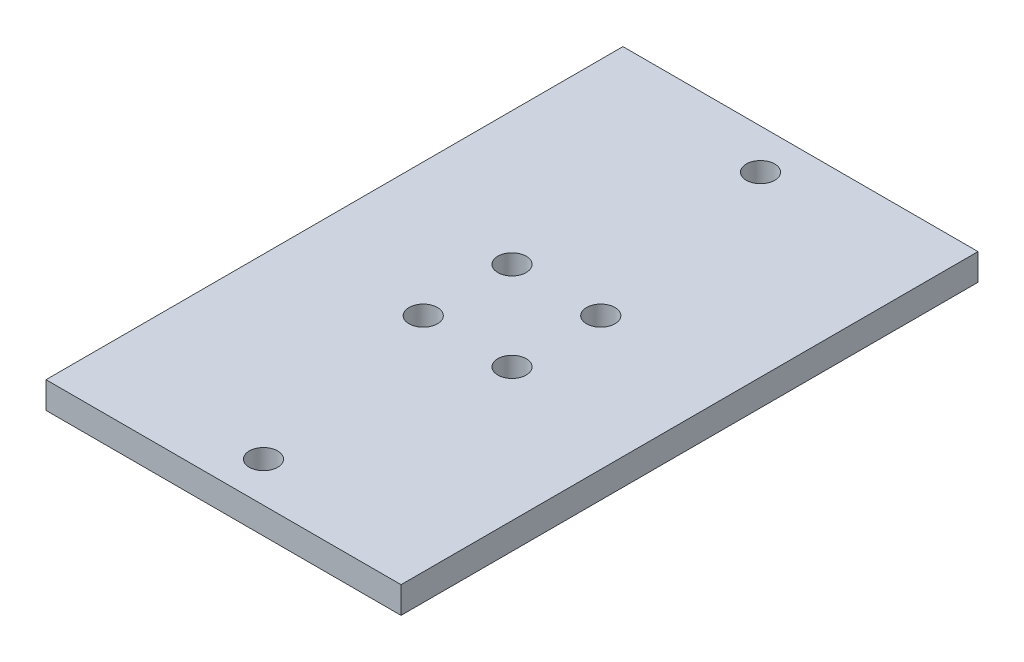
from build123d import *

# Parameters (mm, degrees)
SKETCH_1_W      = 40
SKETCH_1_H      = 65
SKETCH_1_R      = 1.6
EXTRUDE_1_DEPTH = 3


with BuildPart() as part:
    # 草图1 → 凸台-拉伸1 (new body)
    with BuildSketch(Plane(origin=(0, 0, 0), x_dir=(1, 0, 0), z_dir=(0, 1, 0))):
        Rectangle(SKETCH_1_W, SKETCH_1_H)
        with Locations(Location((-5, 5, 0), (0, 0, 270))):
            Circle(SKETCH_1_R, mode=Mode.SUBTRACT)
        with Locations(Location((-5, -5, 0), (0, 0, 90))):
            Circle(SKETCH_1_R, mode=Mode.SUBTRACT)
        with Locations(Location((5, -5, 0), (0, 0, 270))):
            Circle(SKETCH_1_R, mode=Mode.SUBTRACT)
        with Locations(Location((5, 5, 0), (0, 0, 90))):
            Circle(SKETCH_1_R, mode=Mode.SUBTRACT)
        with Locations(Location((0, 28, 0), (0, 0, 270))):
            Circle(SKETCH_1_R, mode=Mode.SUBTRACT)
        with Locations(Location((0, -28, 0), (0, 0, 90))):
            Circle(SKETCH_1_R, mode=Mode.SUBTRACT)
    extrude(amount=EXTRUDE_1_DEPTH)


solid = part.part
